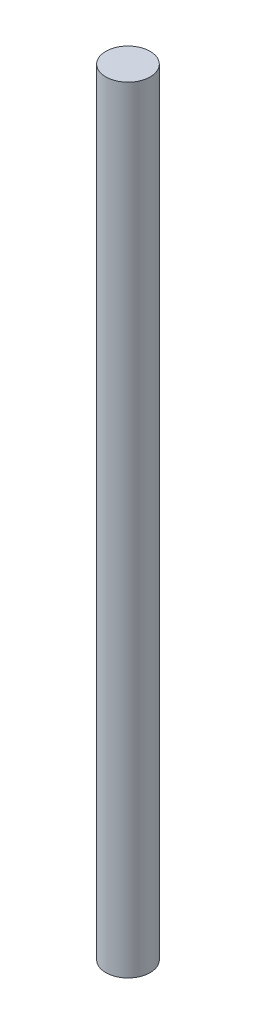
from build123d import *

# Parameters (mm, degrees)
SKETCH2_R           = 4
BOSS_EXTRUDE2_DEPTH = 140


with BuildPart() as part:
    # Sketch2 → Boss-Extrude2 (new body)
    with BuildSketch(Plane(origin=(0, 0, 0), x_dir=(1, 0, 0), z_dir=(0, 1, 0))):
        with Locations(Location((0, 0, 0), (0, 0, 270))):
            Circle(SKETCH2_R)
    extrude(amount=BOSS_EXTRUDE2_DEPTH)


solid = part.part
